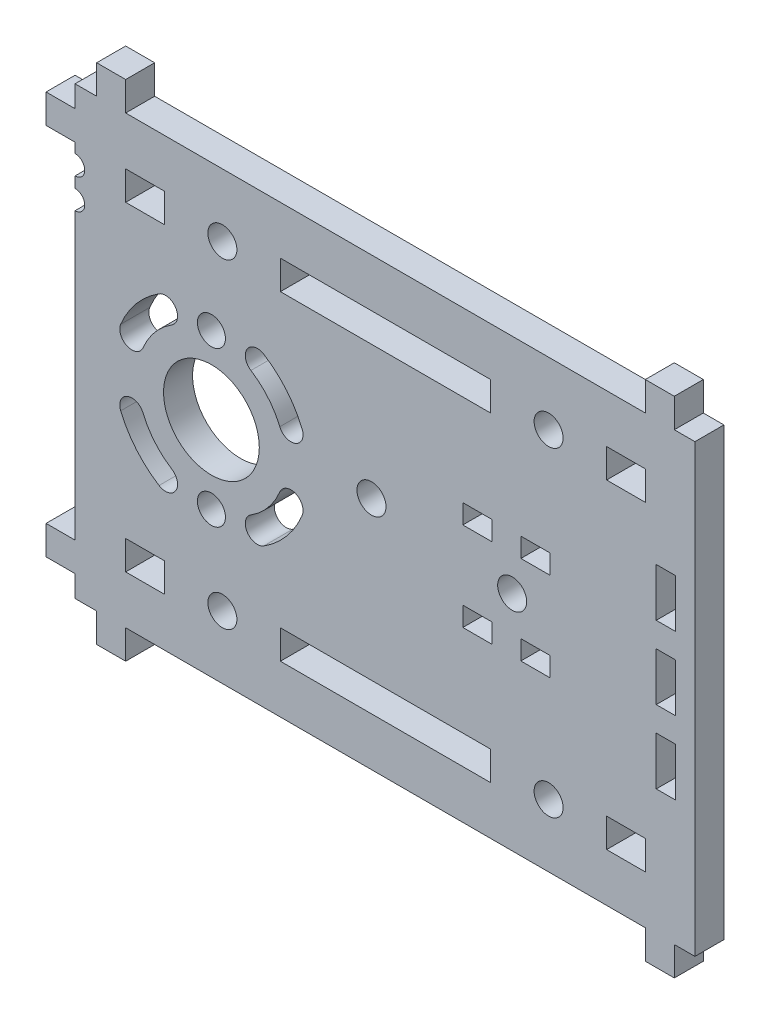
from build123d import *

# Parameters (mm, degrees)
MODEL_R             = 4.950133
MODEL_R_2           = 1.45002
MODEL_R_3           = 1.45
MODEL_R_4           = 1.5
MODEL_W             = 4
MODEL_H             = 3
MODEL_W_2           = 21.736231
MODEL_W_3           = 3
MODEL_H_2           = 2
MODEL_W_4           = 2
MODEL_H_3           = 5
BOSS_EXTRUDE1_DEPTH = 3


with BuildPart() as part:
    # Model → Boss-Extrude1 (new body)
    with BuildSketch(Plane.XY):
        with BuildLine():
            Line((330.563429791, 166.163919592), (330.563429791, 120.063919592))
            Line((330.563429791, 120.063919592), (328.431544791, 120.063919592))
            Line((328.431544791, 120.063919592), (328.431544791, 117.063919592))
            Line((328.431544791, 117.063919592), (325.431544791, 117.063919592))
            Line((325.431544791, 117.063919592), (325.431544791, 120.063919592))
            Line((325.431544791, 120.063919592), (271.695313791, 120.063919592))
            Line((271.695313791, 120.063919592), (271.695313791, 117.063919592))
            Line((271.695313791, 117.063919592), (268.695313791, 117.063919592))
            Line((268.695313791, 117.063919592), (268.695313791, 120.063919592))
            Line((268.695313791, 120.063919592), (266.463429791, 120.063919592))
            Line((266.463429791, 120.063919592), (266.463429791, 122.295819592))
            Line((266.463429791, 122.295819592), (263.463429791, 122.295819592))
            Line((263.463429791, 122.295819592), (263.463429791, 125.295819592))
            Line((263.463429791, 125.295819592), (266.463429791, 125.295819592))
            Line((266.463429791, 125.295819592), (266.463429791, 154.799800566))
            ThreePointArc((266.463429791, 154.799800566), (267.463429791, 155.799800566), (266.463429791, 156.799800566))
            Line((266.463429791, 156.799800566), (266.463429791, 157.915840878))
            ThreePointArc((266.463429791, 157.915840878), (267.463429791, 158.915840878), (266.463429791, 159.915840878))
            Line((266.463429791, 159.915840878), (266.463429791, 160.932019592))
            Line((266.463429791, 160.932019592), (263.463429791, 160.932019592))
            Line((263.463429791, 160.932019592), (263.463429791, 163.932019592))
            Line((263.463429791, 163.932019592), (266.463429791, 163.932019592))
            Line((266.463429791, 163.932019592), (266.463429791, 166.163919592))
            Line((266.463429791, 166.163919592), (268.695313791, 166.163919592))
            Line((268.695313791, 166.163919592), (268.695313791, 169.163919592))
            Line((268.695313791, 169.163919592), (271.695313791, 169.163919592))
            Line((271.695313791, 169.163919592), (271.695313791, 166.163919592))
            Line((271.695313791, 166.163919592), (325.431544791, 166.163919592))
            Line((325.431544791, 166.163919592), (325.431544791, 169.163919592))
            Line((325.431544791, 169.163919592), (328.431544791, 169.163919592))
            Line((328.431544791, 169.163919592), (328.431544791, 166.163919592))
            Line((328.431544791, 166.163919592), (330.563429791, 166.163919592))
        make_face()
        with Locations((280.563429657, 143.113919537)):
            Circle(MODEL_R, mode=Mode.SUBTRACT)
        with Locations((280.563429791, 151.113919592)):
            Circle(MODEL_R_2, mode=Mode.SUBTRACT)
        with Locations((280.563429791, 135.113919592)):
            Circle(MODEL_R_3, mode=Mode.SUBTRACT)
        with Locations((315.431544791, 159.663919592)):
            Circle(MODEL_R_4, mode=Mode.SUBTRACT)
        with Locations((281.695313791, 159.663919592)):
            Circle(MODEL_R_4, mode=Mode.SUBTRACT)
        with Locations((315.431544791, 126.563919592)):
            Circle(MODEL_R_4, mode=Mode.SUBTRACT)
        with Locations((281.695313791, 126.563919592)):
            Circle(MODEL_R_4, mode=Mode.SUBTRACT)
        with Locations((311.663429791, 143.113919592)):
            Circle(MODEL_R_4, mode=Mode.SUBTRACT)
        with Locations((297.116645225, 144.3593347)):
            Circle(MODEL_R_4, mode=Mode.SUBTRACT)
        with Locations((273.695313791, 159.663919592)):
            Rectangle(MODEL_W, MODEL_H, mode=Mode.SUBTRACT)
        with Locations((298.563429291, 159.663919592)):
            Rectangle(MODEL_W_2, MODEL_H, mode=Mode.SUBTRACT)
        with Locations((323.431544791, 159.663919592)):
            Rectangle(MODEL_W, MODEL_H, mode=Mode.SUBTRACT)
        with Locations((273.695313791, 126.563919592)):
            Rectangle(MODEL_W, MODEL_H, mode=Mode.SUBTRACT)
        with Locations((298.563429291, 126.563919592)):
            Rectangle(MODEL_W_2, MODEL_H, mode=Mode.SUBTRACT)
        with Locations((323.431544791, 126.563919592)):
            Rectangle(MODEL_W, MODEL_H, mode=Mode.SUBTRACT)
        with Locations((314.063465132, 147.705010706)):
            Rectangle(MODEL_W_3, MODEL_H_2, mode=Mode.SUBTRACT)
        with Locations((308.063465132, 147.705010706)):
            Rectangle(MODEL_W_3, MODEL_H_2, mode=Mode.SUBTRACT)
        with Locations((314.063465132, 138.522828477)):
            Rectangle(MODEL_W_3, MODEL_H_2, mode=Mode.SUBTRACT)
        with Locations((308.063465132, 138.522828477)):
            Rectangle(MODEL_W_3, MODEL_H_2, mode=Mode.SUBTRACT)
        with Locations((327.563465132, 150.663919592)):
            Rectangle(MODEL_W_4, MODEL_H_3, mode=Mode.SUBTRACT)
        with Locations((327.563465132, 143.113919592)):
            Rectangle(MODEL_W_4, MODEL_H_3, mode=Mode.SUBTRACT)
        with Locations((327.563465132, 135.563919592)):
            Rectangle(MODEL_W_4, MODEL_H_3, mode=Mode.SUBTRACT)
        with BuildLine():
            ThreePointArc((275.146294982, 151.69745945), (272.799630894, 149.651957033), (271.18327611, 146.991447741))
            ThreePointArc((271.18327611, 146.991447741), (271.860939302, 145.358728353), (273.49365869, 146.036391545))
            ThreePointArc((273.49365869, 146.036391545), (274.711896566, 148.041603035), (276.48056463, 149.583287152))
            ThreePointArc((276.48056463, 149.583287152), (276.870515955, 151.307508126), (275.146294982, 151.69745945))
        make_face(mode=Mode.SUBTRACT)
        with BuildLine():
            ThreePointArc((271.183276501, 139.236391494), (272.799631045, 136.575882517), (275.146294756, 134.530380266))
            ThreePointArc((275.146294756, 134.530380266), (276.870515729, 134.92033159), (276.480564405, 136.644552563))
            ThreePointArc((276.480564405, 136.644552563), (274.711896718, 138.186236515), (273.493659081, 140.191447689))
            ThreePointArc((273.493659081, 140.191447689), (271.860939693, 140.869110881), (271.183276501, 139.236391494))
        make_face(mode=Mode.SUBTRACT)
        with BuildLine():
            ThreePointArc((289.943583204, 146.991447741), (288.327228421, 149.651957033), (285.980564333, 151.69745945))
            ThreePointArc((285.980564333, 151.69745945), (284.25634336, 151.307508126), (284.646294684, 149.583287152))
            ThreePointArc((284.646294684, 149.583287152), (286.414962749, 148.041603035), (287.633200625, 146.036391545))
            ThreePointArc((287.633200625, 146.036391545), (289.265920012, 145.358728353), (289.943583204, 146.991447741))
        make_face(mode=Mode.SUBTRACT)
        with BuildLine():
            ThreePointArc((284.64629491, 136.644552563), (286.414962597, 138.186236515), (287.633200234, 140.191447689))
            ThreePointArc((287.633200234, 140.191447689), (289.265919735, 140.869110884), (289.94358293, 139.236391383))
            ThreePointArc((289.94358293, 139.236391383), (288.327228286, 136.575882304), (285.980564432, 134.530380008))
            ThreePointArc((285.980564432, 134.530380008), (284.256343393, 134.920331525), (284.64629491, 136.644552563))
        make_face(mode=Mode.SUBTRACT)
    extrude(amount=BOSS_EXTRUDE1_DEPTH)


solid = part.part
